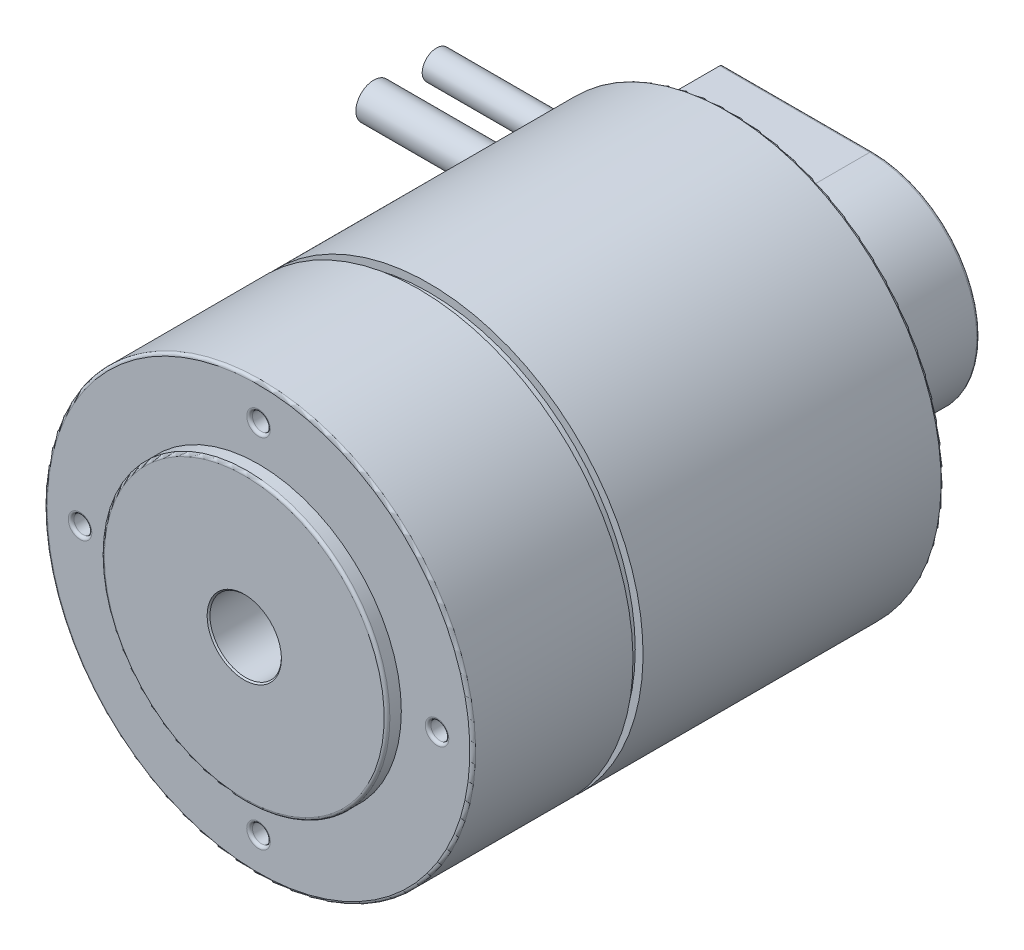
from build123d import *

# Parameters (mm, degrees)
SKETCH1_R                         = 6.34365
DRIVE_SHAFT_BOSS_EXTRUDE1_DEPTH   = 31.75
SKETCH2_W                         = 12.7
SKETCH2_H                         = 5.08
SHAFT_FLAT_CUT_EXTRUDE1_DEPTH     = 19.05
SHAFT_CHAMFER1_SIZE               = 0.8128
SKETCH3_R                         = 25.4
SERVOFLANGEBOSS_EXTRUDE2_DEPTH    = 2.54
SKETCH4_R                         = 38.1
MOTOR_BODY_BOSS_EXTRUDE3_DEPTH    = 83.82
ENCODER_BOSS_EXTRUDE4_DEPTH       = 25.4
SKETCH6_R                         = 3.175
SKETCH6_R_2                       = 2.54
CABLES_BOSS_EXTRUDE5_DEPTH        = 71.12
HOUSING_FILLET1_R                 = 0.508
SKETCH7_R                         = 1.5875
BOLT_HOLES_CUT_EXTRUDE2_DEPTH     = 7.62
BOLT_HOLE_FILLET2_R               = 0.508
SHAFT_HOLECUT_EXTRUDE1_DEPTH      = 138.840349761
SHAFT_HOLECUT_EXTRUDE1_DEPTH_BACK = 25.4
SKETCH8_R                         = 6.35
CHAMFER1_SIZE                     = 0.254
SKETCH9_W                         = 1.790834313
SKETCH9_H                         = 3.820446533


with BuildPart() as part:
    # Sketch1 → Drive Shaft Boss-Extrude1 (new body)
    with BuildSketch(Plane.XY):
        Circle(SKETCH1_R)
    extrude(amount=-DRIVE_SHAFT_BOSS_EXTRUDE1_DEPTH)

    # Sketch2 → Shaft Flat Cut-Extrude1 (cut)
    with BuildSketch(Plane.XY):
        with Locations((0, 7.62)):
            Rectangle(SKETCH2_W, SKETCH2_H)
    extrude(amount=-SHAFT_FLAT_CUT_EXTRUDE1_DEPTH, mode=Mode.SUBTRACT)

    # Shaft_Chamfer1
    shaft_chamfer1_edges = [part.edges().sort_by_distance(p)[0] for p in [
        (-2.840755677, -5.672036892, 0),
    ]]
    chamfer(shaft_chamfer1_edges, length=SHAFT_CHAMFER1_SIZE)

    # Sketch3 → ServoFlangeBoss-Extrude2 (add)
    with BuildSketch(Plane(origin=(0, 0, -31.75), x_dir=(-1, 0, 0), z_dir=(0, 0, -1))):
        Circle(SKETCH3_R)
    extrude(amount=SERVOFLANGEBOSS_EXTRUDE2_DEPTH)

    # Sketch4 → Motor Body Boss-Extrude3 (add)
    with BuildSketch(Plane(origin=(0, 0, -34.29), x_dir=(-1, 0, 0), z_dir=(0, 0, -1))):
        Circle(SKETCH4_R)
    extrude(amount=MOTOR_BODY_BOSS_EXTRUDE3_DEPTH)

    # Sketch5 → Encoder Boss-Extrude4 (add)
    with BuildSketch(Plane(origin=(0, 0, -118.11), x_dir=(-1, 0, 0), z_dir=(0, 0, -1))):
        with BuildLine():
            Line((0, 19.05), (26.67, 19.05))
            Line((26.67, 19.05), (26.67, -19.05))
            Line((26.67, -19.05), (0, -19.05))
            ThreePointArc((0, -19.05), (-19.05, 0), (0, 19.05))
        make_face()
    extrude(amount=ENCODER_BOSS_EXTRUDE4_DEPTH)

    # Sketch6 → Cables Boss-Extrude5 (add)
    with BuildSketch(Plane(origin=(0, 0, 0), x_dir=(0, 0, -1), z_dir=(1, 0, 0))):
        with Locations((125.898496111, 0)):
            Circle(SKETCH6_R)
        with Locations((137.064174403, 0)):
            Circle(SKETCH6_R_2)
    extrude(amount=-CABLES_BOSS_EXTRUDE5_DEPTH)

    # Housing Fillet1
    housing_fillet1_edges = [part.edges().sort_by_distance(p)[0] for p in [
        (25.4, 0, -31.75),
        (38.1, 0, -34.29),
        (38.1, 0, -118.11),
        (19.05, 0, -143.51),
        (-13.335, -19.05, -143.51),
        (-26.67, 0, -143.51),
        (-13.335, 19.05, -143.51),
    ]]
    fillet(housing_fillet1_edges, radius=HOUSING_FILLET1_R)

    # Sketch7 → Bolt Holes Cut-Extrude2 (cut)
    with BuildSketch(Plane.XY.offset(-34.29)):
        with Locations((31.75, 0)):
            Circle(SKETCH7_R)
        with Locations((0, -31.75)):
            Circle(SKETCH7_R)
        with Locations((-31.75, 0)):
            Circle(SKETCH7_R)
        with Locations((0, 31.75)):
            Circle(SKETCH7_R)
    extrude(amount=-BOLT_HOLES_CUT_EXTRUDE2_DEPTH, mode=Mode.SUBTRACT)

    # Bolt Hole Fillet2
    bolt_hole_fillet2_edges = [part.edges().sort_by_distance(p)[0] for p in [
        (30.1625, 0, -34.29),
        (-1.5875, -31.75, -34.29),
        (-33.3375, 0, -34.29),
        (-1.5875, 31.75, -34.29),
    ]]
    fillet(bolt_hole_fillet2_edges, radius=BOLT_HOLE_FILLET2_R)

    # Sketch8 → Shaft HoleCut-Extrude1 (cut, two sides: drawn at the far end of the back side and taken through both)
    with BuildSketch(Plane.XY.offset(-31.75).offset(-SHAFT_HOLECUT_EXTRUDE1_DEPTH_BACK)):
        Circle(SKETCH8_R)
    extrude(amount=SHAFT_HOLECUT_EXTRUDE1_DEPTH + SHAFT_HOLECUT_EXTRUDE1_DEPTH_BACK, mode=Mode.SUBTRACT)

    # Chamfer1
    chamfer1_edges = [part.edges().sort_by_distance(p)[0] for p in [
        (-6.35, 0, -31.75),
    ]]
    chamfer(chamfer1_edges, length=CHAMFER1_SIZE)

    # Sketch9 → Cut-Revolve1 (revolve, cut)
    with BuildSketch(Plane(origin=(0, 0, 0), x_dir=(0, 0, -1), z_dir=(1, 0, 0)), mode=Mode.PRIVATE) as cut_revolve1_sk:
        with Locations((63.692514688, 38.622326675)):
            Rectangle(SKETCH9_W, SKETCH9_H)
    revolve(cut_revolve1_sk.sketch.rotate(Axis((0, 0, -32.258), (0, 0, -1)), 270), axis=Axis((0, 0, -32.258), (0, 0, -1)), mode=Mode.SUBTRACT)


solid = part.part
